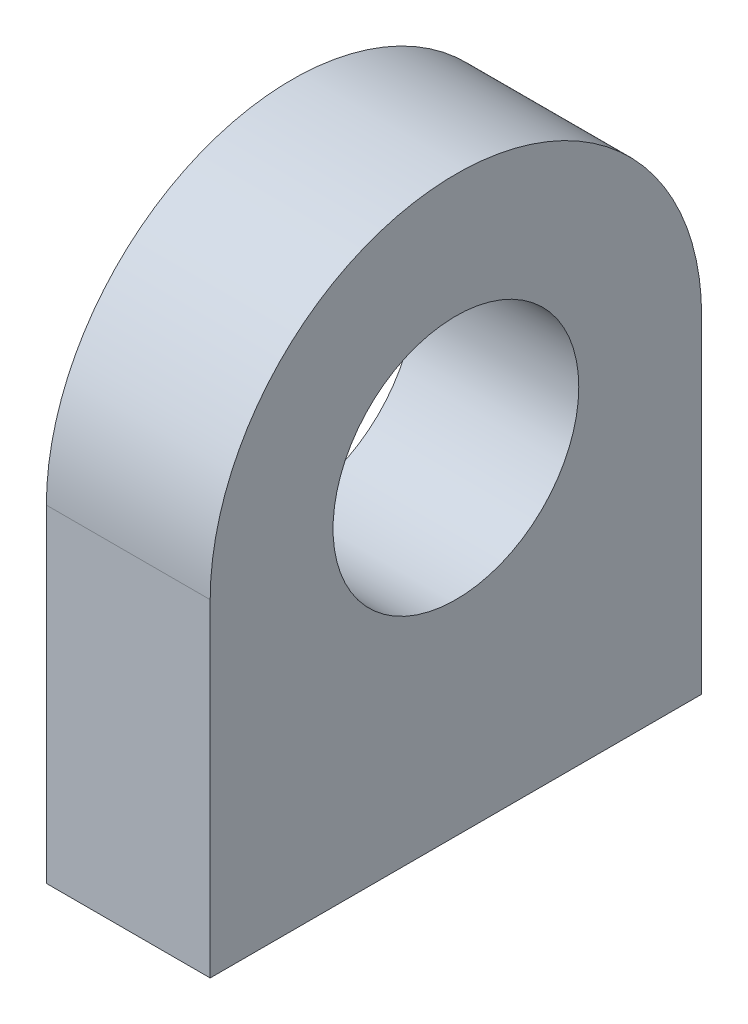
from build123d import *

# Parameters (mm, degrees)
SKETCH1_R           = 7.5
BOSS_EXTRUDE1_DEPTH = 10


with BuildPart() as part:
    # Sketch1 → Boss-Extrude1 (new body)
    with BuildSketch(Plane(origin=(0, 0, 0), x_dir=(0, 0, -1), z_dir=(1, 0, 0))):
        with BuildLine():
            Line((-15, -20), (15, -20))
            Line((15, -20), (15, 0))
            ThreePointArc((15, 0), (0, 15), (-15, 0))
            Line((-15, 0), (-15, -20))
        make_face()
        Circle(SKETCH1_R, mode=Mode.SUBTRACT)
    extrude(amount=BOSS_EXTRUDE1_DEPTH)


solid = part.part
